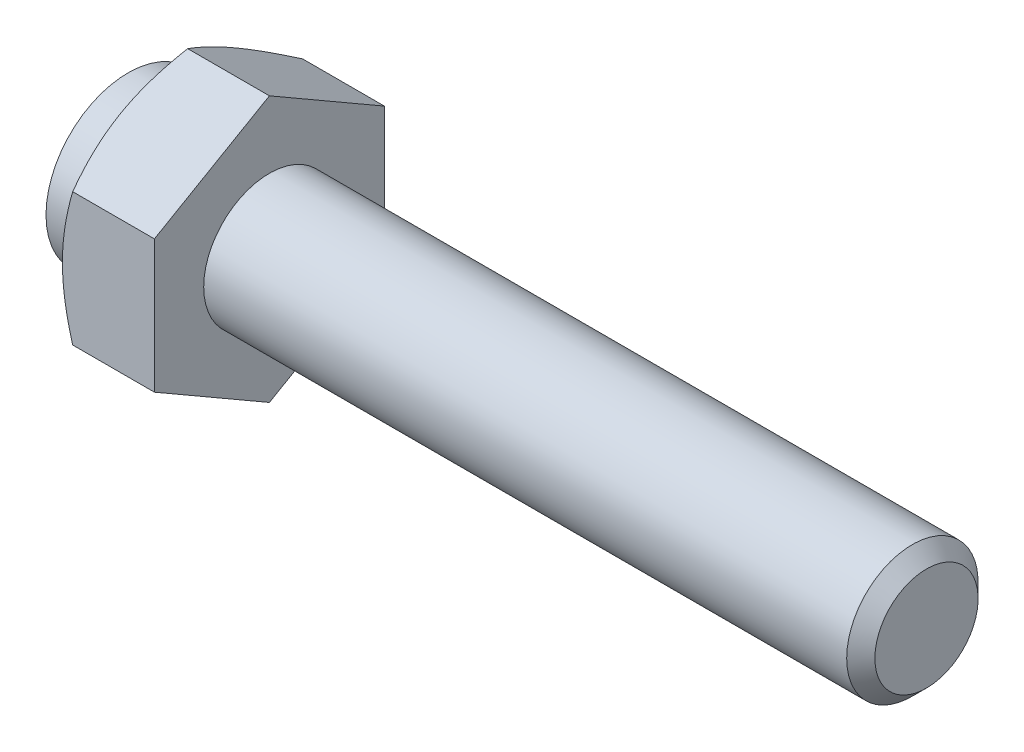
from build123d import *

# Parameters (mm, degrees)
SKETCH_2_W          = 16.2
SKETCH_2_H          = 16.2
CUT_EXTRUDE_1_DEPTH = 4.3


with BuildPart() as part:
    # 草图1 → 旋转1 (revolve)
    with BuildSketch(Plane.XY):
        Polygon((-4.3, 0), (-4.3, 2.5), (-2.8, 2.5), (-2.8, 3.5), (-2.395854812, 4.2), (0, 4.2), (0, 2), (19.5705, 2), (20, 1.5705), (20, 0), align=None)
    revolve(axis=Axis((20, 0, 0), (-1, 0, 0)))

    # 草图2 → 切除-拉伸1 (cut)
    with BuildSketch(Plane(origin=(0, 0, 0), x_dir=(0, 0, -1), z_dir=(1, 0, 0))):
        Rectangle(SKETCH_2_W, SKETCH_2_H)
        Polygon((-3.5, 2.020725942), (-3.5, -2.020725942), (0, -4.041451884), (3.5, -2.020725942), (3.5, 2.020725942), (0, 4.041451884), align=None, mode=Mode.SUBTRACT)
    extrude(amount=-CUT_EXTRUDE_1_DEPTH, mode=Mode.SUBTRACT)


solid = part.part
